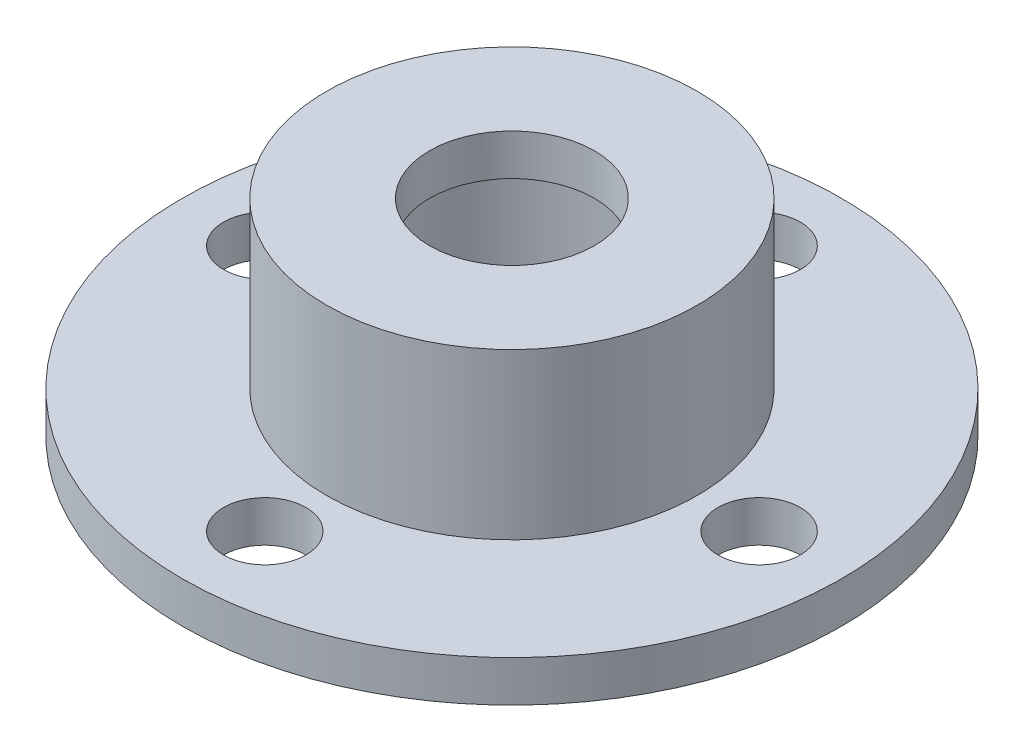
from build123d import *

# Parameters (mm, degrees)
BOSS_EXTRUDE1_DEPTH = 25.4
SKETCH2_R           = 114.3
SKETCH2_R_2         = 50.8
BOSS_EXTRUDE3_DEPTH = 101.6
SKETCH3_R           = 76.2
CUT_EXTRUDE1_DEPTH  = 101.6


with BuildPart() as part:
    # Sketch1 → Boss-Extrude1 (new body)
    with BuildSketch(Plane(origin=(0, 0, 0), x_dir=(1, 0, 0), z_dir=(0, 1, 0))):
        with BuildLine():
            ThreePointArc((-203.2, 0), (-143.684097937, -143.684097937), (0, -203.2))
            Line((0, -203.2), (0, -177.8))
            ThreePointArc((0, -177.8), (-18.693893834, -169.59588129), (-25.311651906, -150.283333333))
            ThreePointArc((-25.311651906, -150.283333333), (-107.763073453, -107.763073453), (-150.283333333, -25.311651906))
            ThreePointArc((-150.283333333, -25.311651906), (-169.59588129, -18.693893834), (-177.8, 0))
            Line((-177.8, 0), (-203.2, 0))
        make_face()
        with BuildLine():
            ThreePointArc((-150.283333333, -25.311651906), (-107.763073453, -107.763073453), (-25.311651906, -150.283333333))
            ThreePointArc((-25.311651906, -150.283333333), (-17.19588129, -133.706106166), (0, -127))
            Line((0, -127), (0, -50.8))
            ThreePointArc((0, -50.8), (-35.921024484, -35.921024484), (-50.8, 0))
            Line((-50.8, 0), (-127, 0))
            ThreePointArc((-127, 0), (-133.706106166, -17.19588129), (-150.283333333, -25.311651906))
        make_face()
        with BuildLine():
            ThreePointArc((0, 203.2), (-143.684097937, 143.684097937), (-203.2, 0))
            Line((-203.2, 0), (-177.8, 0))
            ThreePointArc((-177.8, 0), (-169.59588129, 18.693893834), (-150.283333333, 25.311651906))
            ThreePointArc((-150.283333333, 25.311651906), (-107.763073453, 107.763073453), (-25.311651906, 150.283333333))
            ThreePointArc((-25.311651906, 150.283333333), (-18.693893834, 169.59588129), (0, 177.8))
            Line((0, 177.8), (0, 203.2))
        make_face()
        with BuildLine():
            ThreePointArc((-25.311651906, 150.283333333), (-107.763073453, 107.763073453), (-150.283333333, 25.311651906))
            ThreePointArc((-150.283333333, 25.311651906), (-133.706106166, 17.19588129), (-127, 0))
            Line((-127, 0), (-50.8, 0))
            ThreePointArc((-50.8, 0), (-35.921024484, 35.921024484), (0, 50.8))
            Line((0, 50.8), (0, 127))
            ThreePointArc((0, 127), (-17.19588129, 133.706106166), (-25.311651906, 150.283333333))
        make_face()
        with BuildLine():
            Line((0, -50.8), (0, -127))
            ThreePointArc((0, -127), (17.19588129, -133.706106166), (25.311651906, -150.283333333))
            ThreePointArc((25.311651906, -150.283333333), (107.763073453, -107.763073453), (150.283333333, -25.311651906))
            ThreePointArc((150.283333333, -25.311651906), (133.706106166, -17.19588129), (127, 0))
            Line((127, 0), (50.8, 0))
            ThreePointArc((50.8, 0), (35.921024484, -35.921024484), (0, -50.8))
        make_face()
        with BuildLine():
            Line((0, -177.8), (0, -203.2))
            ThreePointArc((0, -203.2), (143.684097937, -143.684097937), (203.2, 0))
            Line((203.2, 0), (177.8, 0))
            ThreePointArc((177.8, 0), (169.59588129, -18.693893834), (150.283333333, -25.311651906))
            ThreePointArc((150.283333333, -25.311651906), (107.763073453, -107.763073453), (25.311651906, -150.283333333))
            ThreePointArc((25.311651906, -150.283333333), (25.377903365, -151.340745172), (25.4, -152.4))
            ThreePointArc((25.4, -152.4), (17.960512242, -170.360512242), (0, -177.8))
        make_face()
        with BuildLine():
            ThreePointArc((127, 0), (133.706106166, 17.19588129), (150.283333333, 25.311651906))
            ThreePointArc((150.283333333, 25.311651906), (107.763073453, 107.763073453), (25.311651906, 150.283333333))
            ThreePointArc((25.311651906, 150.283333333), (17.19588129, 133.706106166), (0, 127))
            Line((0, 127), (0, 50.8))
            ThreePointArc((0, 50.8), (35.921024484, 35.921024484), (50.8, 0))
            Line((50.8, 0), (127, 0))
        make_face()
        with BuildLine():
            Line((177.8, 0), (203.2, 0))
            ThreePointArc((203.2, 0), (143.684097937, 143.684097937), (0, 203.2))
            Line((0, 203.2), (0, 177.8))
            ThreePointArc((0, 177.8), (17.960512242, 170.360512242), (25.4, 152.4))
            ThreePointArc((25.4, 152.4), (25.377903365, 151.340745172), (25.311651906, 150.283333333))
            ThreePointArc((25.311651906, 150.283333333), (107.763073453, 107.763073453), (150.283333333, 25.311651906))
            ThreePointArc((150.283333333, 25.311651906), (169.59588129, 18.693893834), (177.8, 0))
        make_face()
    extrude(amount=BOSS_EXTRUDE1_DEPTH)

    # Sketch2 → Boss-Extrude3 (add)
    with BuildSketch(Plane(origin=(0, 25.4, 0), x_dir=(1, 0, 0), z_dir=(0, 1, 0))):
        with Locations(Location((0, 0, 0), (0, 0, 270))):
            Circle(SKETCH2_R)
        with Locations(Location((0, 0, 0), (0, 0, 270))):
            Circle(SKETCH2_R_2, mode=Mode.SUBTRACT)
    extrude(amount=BOSS_EXTRUDE3_DEPTH)

    # Sketch3 → Cut-Extrude1 (cut)
    with BuildSketch(Plane.XZ):
        with Locations(Location((0, 0, 0), (0, 0, 270))):
            Circle(SKETCH3_R)
    extrude(amount=-CUT_EXTRUDE1_DEPTH, mode=Mode.SUBTRACT)


solid = part.part
